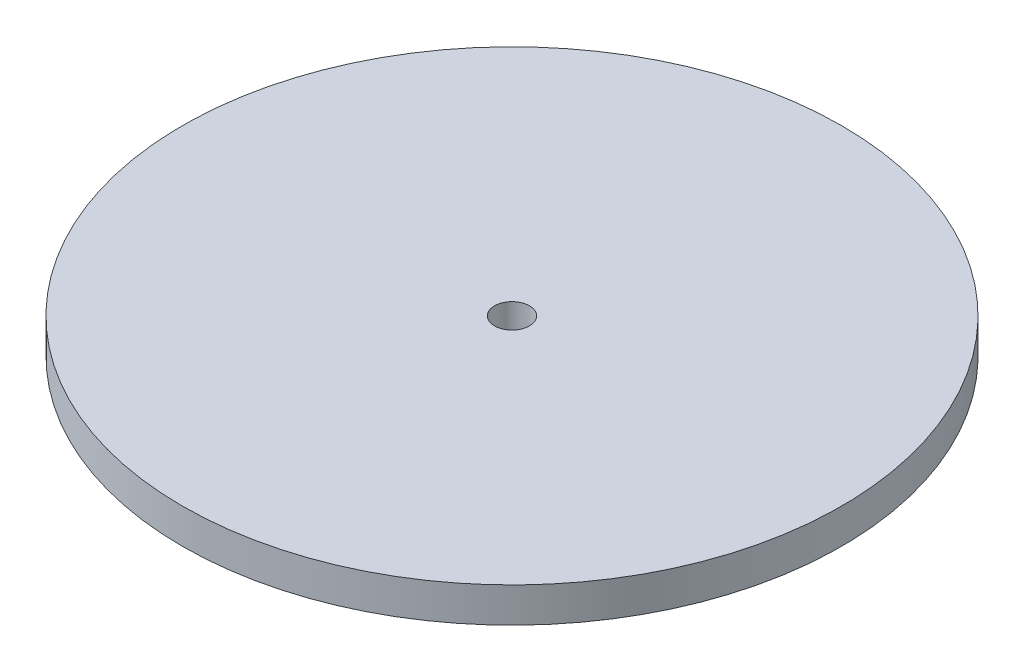
from build123d import *

# Parameters (mm, degrees)
SKETCH1_R           = 37.8
SKETCH1_R_2         = 2
BOSS_EXTRUDE1_DEPTH = 4


with BuildPart() as part:
    # Sketch1 → Boss-Extrude1 (new body)
    with BuildSketch(Plane(origin=(0, 0, 0), x_dir=(1, 0, 0), z_dir=(0, 1, 0))):
        with Locations(Location((0, 0, 0), (0, 0, 270))):
            Circle(SKETCH1_R)
        with Locations(Location((0, 0, 0), (0, 0, 270))):
            Circle(SKETCH1_R_2, mode=Mode.SUBTRACT)
    extrude(amount=BOSS_EXTRUDE1_DEPTH)


solid = part.part
